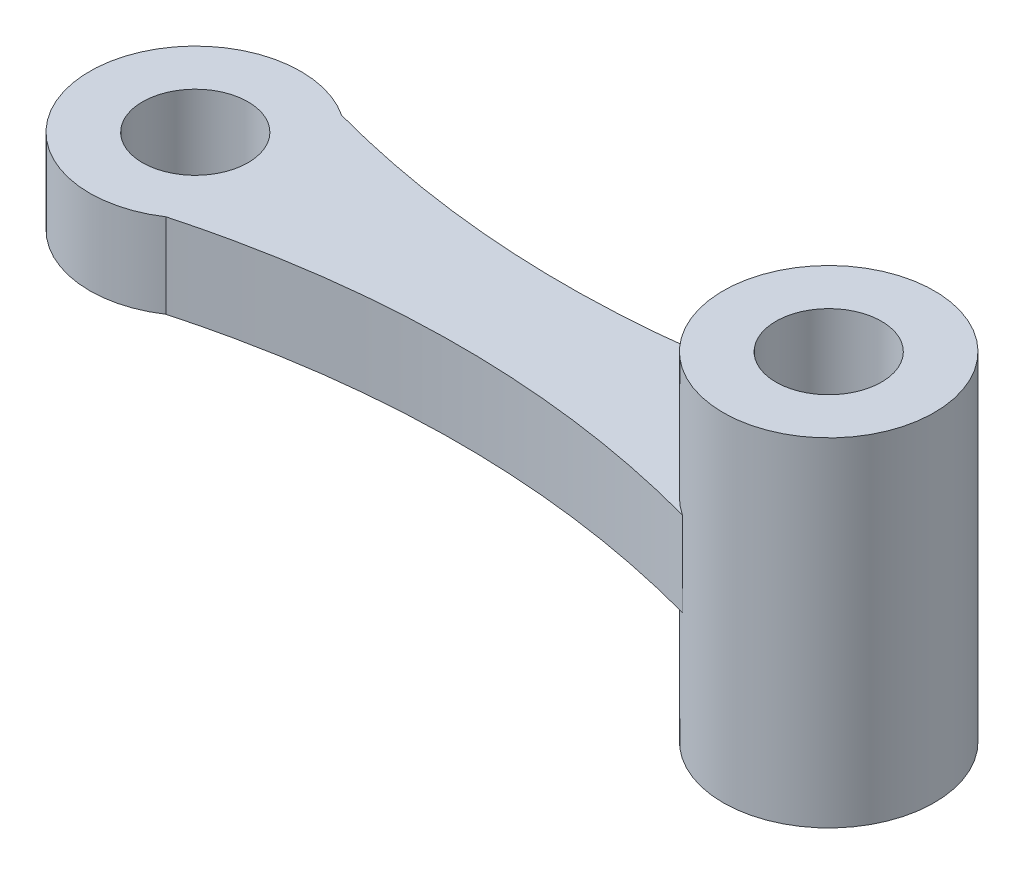
from build123d import *

# Parameters (mm, degrees)
SKETCH1_R                = 2.5
BOSS_EXTRUDE1_DEPTH      = 4
BOSS_EXTRUDE3_DEPTH      = 8
BOSS_EXTRUDE3_DEPTH_BACK = 8
SKETCH3_R                = 5
SKETCH3_R_2              = 2.5
CUT_EXTRUDE1_START       = -10
CUT_EXTRUDE1_DEPTH       = 10


with BuildPart() as part:
    # Sketch1 → Boss-Extrude1 (new body)
    with BuildSketch(Plane(origin=(0, 0, 0), x_dir=(1, 0, 0), z_dir=(0, 1, 0))):
        with BuildLine():
            Line((0, 5), (30, 5))
            ThreePointArc((30, 5), (35, 0), (30, -5))
            Line((30, -5), (0, -5))
            ThreePointArc((0, -5), (-5, 0), (0, 5))
        make_face()
        with Locations(Location((0, 0, 0), (0, 0, 270))):
            Circle(SKETCH1_R, mode=Mode.SUBTRACT)
        with Locations(Location((30, 0, 0), (0, 0, 270))):
            Circle(SKETCH1_R, mode=Mode.SUBTRACT)
    extrude(amount=BOSS_EXTRUDE1_DEPTH)

    # Sketch3 → Boss-Extrude3 (add, two sides: drawn at the far end of the back side and taken through both)
    with BuildSketch(Plane(origin=(0, 2, 0), x_dir=(1, 0, 0), z_dir=(0, 1, 0)).offset(-BOSS_EXTRUDE3_DEPTH_BACK)):
        with Locations(Location((30, 0, 0), (0, 0, 270))):
            Circle(SKETCH3_R)
        with Locations(Location((30, 0, 0), (0, 0, 270))):
            Circle(SKETCH3_R_2, mode=Mode.SUBTRACT)
    extrude(amount=BOSS_EXTRUDE3_DEPTH + BOSS_EXTRUDE3_DEPTH_BACK)

    # Sketch4 → Cut-Extrude1 (cut)
    with BuildSketch(Plane(origin=(0, 4, 0), x_dir=(1, 0, 0), z_dir=(0, 1, 0)).offset(CUT_EXTRUDE1_START)):
        with BuildLine():
            Line((0, -5), (30, -5))
            ThreePointArc((30, -5), (28.552126, -4.785777), (27.228319, -4.161464))
            add(Edge.make_bspline(
                [(2.771681, -4.161464), (6.847787, -3.053821), (15, -1.946179), (23.152213, -3.053821), (27.228319, -4.161464)],
                knots=[0.092389, 0.092389, 0.092389, 0.092389, 0.5, 0.907611, 0.907611, 0.907611, 0.907611], degree=3))
            ThreePointArc((2.771681, -4.161464), (1.447874, -4.785777), (0, -5))
        make_face()
        with BuildLine():
            Line((0, 5), (30, 5))
            ThreePointArc((30, 5), (28.552126, 4.785777), (27.228319, 4.161464))
            add(Edge.make_bspline(
                [(2.771681, 4.161464), (6.847787, 3.053821), (15, 1.946179), (23.152213, 3.053821), (27.228319, 4.161464)],
                knots=[0.092389, 0.092389, 0.092389, 0.092389, 0.5, 0.907611, 0.907611, 0.907611, 0.907611], degree=3))
            ThreePointArc((2.771681, 4.161464), (1.447874, 4.785777), (0, 5))
        make_face()
    extrude(amount=CUT_EXTRUDE1_DEPTH, mode=Mode.SUBTRACT)


solid = part.part
